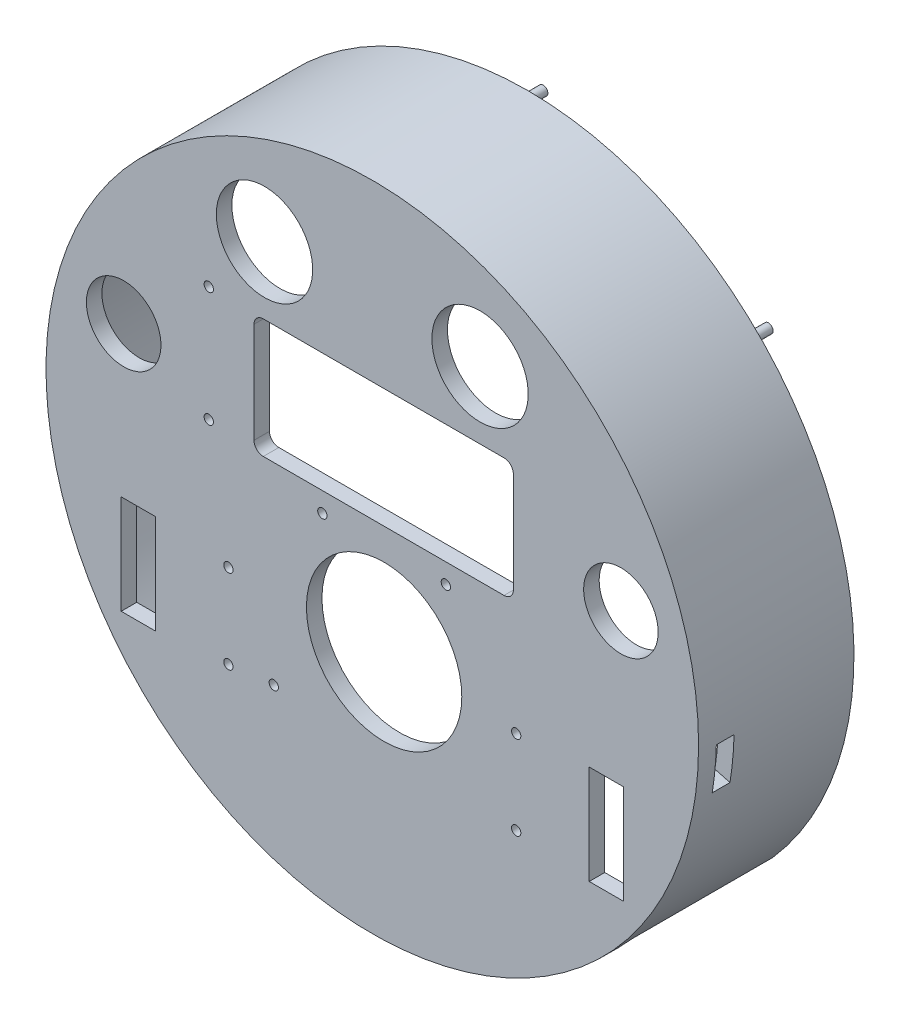
from build123d import *

# Parameters (mm, degrees)
ESQUISSE1_R              = 105
BOSS_EXTRU_1_DEPTH       = 50
COQUE1_T                 = -5
ESQUISSE3_R              = 25
ESQUISSE3_R_2            = 1.5
ENL_V_MAT_EXTRU_1_DEPTH  = 10
ENL_V_MAT_EXTRU_2_DEPTH  = 156.161206492
ENL_V_MAT_EXTRU_3_DEPTH  = 45
ESQUISSE7_R              = 1.5
ENL_V_MAT_EXTRU_4_DEPTH  = 156.161206492
ESQUISSE8_W              = 11
ESQUISSE8_H              = 31.895350387
ENL_V_MAT_EXTRU_5_DEPTH  = 5
ESQUISSE9_R              = 15.5
ENL_V_MAT_EXTRU_7_DEPTH  = 156.161206492
BALAYAGE1_PROFILE_R      = 1.5
BOSS_EXTRU_2_START       = 1
BOSS_EXTRU_2_DEPTH       = 1
BALAYAGE2_PROFILE_R      = 1.5
BOSS_EXTRU_3_START       = 2
BOSS_EXTRU_3_DEPTH       = 2
ESQUISSE30_R             = 1.5
BOSS_EXTRU_4_DEPTH       = 5
ESQUISSE31_R             = 12
ENL_V_MAT_EXTRU_8_DEPTH  = 5
ESQUISSE32_W             = 5.713355649
ESQUISSE32_H             = 13.88652285
ENL_V_MAT_EXTRU_10_DEPTH = 352.816395688


with BuildPart() as part:
    # Esquisse1 → Boss.-Extru.1 (new body)
    with BuildSketch(Plane.XY):
        Circle(ESQUISSE1_R)
    extrude(amount=BOSS_EXTRU_1_DEPTH)

    # Coque1
    coque1_openings = [part.faces().sort_by_distance(p)[0] for p in [
        (0, 0, 0),
    ]]
    offset(amount=COQUE1_T, openings=coque1_openings, kind=Kind.INTERSECTION)

    # Esquisse3 → Enlèv. mat.-Extru.1 (cut)
    with BuildSketch(Plane(origin=(0, 0, 45), x_dir=(-1, 0, 0), z_dir=(0, 0, -1))):
        with Locations((-3.8, -24.557615642)):
            Circle(ESQUISSE3_R)
        with Locations((-23.669465397, 4.134521322)):
            Circle(ESQUISSE3_R_2)
        with Locations((16.069465397, 4.134521322)):
            Circle(ESQUISSE3_R_2)
        with Locations((31.7, -51.557615642)):
            Circle(ESQUISSE3_R_2)
    extrude(amount=-ENL_V_MAT_EXTRU_1_DEPTH, mode=Mode.SUBTRACT)

    # Esquisse5 → Enlèv. mat.-Extru.2 (cut, through all)
    with BuildSketch(Plane(origin=(0, 0, 45), x_dir=(-1, 0, 0), z_dir=(0, 0, -1))):
        with BuildLine():
            Line((-42.388918531, 10.472597699), (35.07440103, 10.472597699))
            ThreePointArc((35.07440103, 10.472597699), (37.195721374, 11.351277356), (38.07440103, 13.472597699))
            Line((38.07440103, 13.472597699), (38.07440103, 45.806945365))
            ThreePointArc((38.07440103, 45.806945365), (37.195721374, 47.928265708), (35.07440103, 48.806945365))
            Line((35.07440103, 48.806945365), (-42.388918531, 48.806945365))
            ThreePointArc((-42.388918531, 48.806945365), (-44.510238875, 47.928265708), (-45.388918531, 45.806945365))
            Line((-45.388918531, 45.806945365), (-45.388918531, 13.472597699))
            ThreePointArc((-45.388918531, 13.472597699), (-44.510238875, 11.351277356), (-42.388918531, 10.472597699))
        make_face()
    extrude(amount=-ENL_V_MAT_EXTRU_2_DEPTH, mode=Mode.SUBTRACT)

    # Esquisse6 → Enlèv. mat.-Extru.3 (cut)
    with BuildSketch(Plane(origin=(0, 0, 0), x_dir=(-1, 0, 0), z_dir=(0, 0, -1))):
        with BuildLine():
            Line((-78.81072608, -69.38205427), (78.81072608, -69.38205427))
            ThreePointArc((78.81072608, -69.38205427), (0, -105), (-78.81072608, -69.38205427))
        make_face()
    extrude(amount=-ENL_V_MAT_EXTRU_3_DEPTH, mode=Mode.SUBTRACT)

    # Esquisse7 → Enlèv. mat.-Extru.4 (cut, through all)
    with BuildSketch(Plane(origin=(0, 0, 45), x_dir=(-1, 0, 0), z_dir=(0, 0, -1))):
        with Locations((52.614229855, 48.990085475)):
            Circle(ESQUISSE7_R)
        with Locations((52.614229855, 11.990085475)):
            Circle(ESQUISSE7_R)
        with Locations((46.3, -26.057615642)):
            Circle(ESQUISSE7_R)
        with Locations((46.3, -53.057615642)):
            Circle(ESQUISSE7_R)
        with Locations((-46.3, -26.062213408)):
            Circle(ESQUISSE7_R)
        with Locations((-46.3, -53.062213408)):
            Circle(ESQUISSE7_R)
    extrude(amount=-ENL_V_MAT_EXTRU_4_DEPTH, mode=Mode.SUBTRACT)

    # Esquisse8 → Enlèv. mat.-Extru.5 (cut)
    with BuildSketch(Plane(origin=(0, 0, 45), x_dir=(-1, 0, 0), z_dir=(0, 0, -1))):
        with Locations((-75.3, -39.589403314)):
            Rectangle(ESQUISSE8_W, ESQUISSE8_H)
        with Locations((75.3, -39.589403314)):
            Rectangle(ESQUISSE8_W, ESQUISSE8_H)
    extrude(amount=-ENL_V_MAT_EXTRU_5_DEPTH, mode=Mode.SUBTRACT)

    # Esquisse9 → Enlèv. mat.-Extru.7 (cut, through all)
    with BuildSketch(Plane(origin=(0, 0, 45), x_dir=(-1, 0, 0), z_dir=(0, 0, -1))):
        with Locations((34.681880454, 70.440085475)):
            Circle(ESQUISSE9_R)
        with Locations((-34.681880454, 70.440085475)):
            Circle(ESQUISSE9_R)
    extrude(amount=-ENL_V_MAT_EXTRU_7_DEPTH, mode=Mode.SUBTRACT)

    # Balayage1: sweep along a path in Esquisse10
    with BuildLine(Plane(origin=(-9.681880454, 0.440085475, 22), x_dir=(-1, 0, 0), z_dir=(0, 0, -1))) as balayage1_path:
        Line((-43.221417057, 88.965628134), (-42.925873334, 93.872357698))
    # Balayage1 profile (on start of the path) → Balayage1 (sweep)
    with BuildSketch(Plane(origin=(33.539536603, 89.405713609, 22), x_dir=(0.9981909544337458, 0.060123360573471965, 0), z_dir=(-0.060123360573471965, 0.9981909544337458, 0))):
        Circle(BALAYAGE1_PROFILE_R)
    balayage1 = sweep(path=balayage1_path.line)

    # Esquisse19 → Boss.-Extru.2 (add)
    with BuildSketch(Plane(origin=(-5.53995205, 91.976396052, 0), x_dir=(0.998190954433746, 0.06012336057346903, 0), z_dir=(-0.06012336057346903, 0.998190954433746, 0)).offset(BOSS_EXTRU_2_START)):
        with BuildLine():
            Line((38.85423401, -23.5), (38.85423401, -20.5))
            ThreePointArc((38.85423401, -20.5), (37.35423401, -22), (38.85423401, -23.5))
        make_face()
    boss_extru_2 = extrude(amount=-BOSS_EXTRU_2_DEPTH)

    # Balayage2: sweep along a path in Esquisse20
    with BuildLine(Plane(origin=(-9.681880454, 0.440085475, 22), x_dir=(-1, 0, 0), z_dir=(0, 0, -1))) as balayage2_path:
        Line((-73.311298587, 71.743577457), (-78.469516131, 72.142702967))
    # Balayage2 profile (on start of the path) → Balayage2 (sweep)
    with BuildSketch(Plane(origin=(63.629418133, 72.183662932, 22), x_dir=(-0.07714603625431019, 0.9970198037603109, 0), z_dir=(0.9970198037603109, 0.07714603625431019, 0))):
        Circle(BALAYAGE2_PROFILE_R)
    balayage2 = sweep(path=balayage2_path.line)

    # Esquisse27 → Boss.-Extru.3 (add)
    with BuildSketch(Plane(origin=(73.961032209, 5.722855705, 0), x_dir=(0, 0, -1), z_dir=(0.9970198037603113, 0.07714603625430425, 0)).offset(BOSS_EXTRU_3_START)):
        with BuildLine():
            Line((-20.5, 67.059784053), (-23.5, 67.059784053))
            ThreePointArc((-23.5, 67.059784053), (-22, 65.559784053), (-20.5, 67.059784053))
        make_face()
    boss_extru_3 = extrude(amount=-BOSS_EXTRU_3_DEPTH)

    # Symétrie1: Balayage1, Boss.-Extru.2, Balayage2, Boss.-Extru.3 across plane
    add(balayage1.mirror(Plane(origin=(0, 0, 0), x_dir=(0, 0, 1), z_dir=(1, 0, 0))))
    add(boss_extru_2.mirror(Plane(origin=(0, 0, 0), x_dir=(0, 0, 1), z_dir=(1, 0, 0))))
    add(balayage2.mirror(Plane(origin=(0, 0, 0), x_dir=(0, 0, 1), z_dir=(1, 0, 0))))
    add(boss_extru_3.mirror(Plane(origin=(0, 0, 0), x_dir=(0, 0, 1), z_dir=(1, 0, 0))))

    # Esquisse30 → Boss.-Extru.4 (add)
    with BuildSketch(Plane(origin=(0, 0, 0), x_dir=(-1, 0, 0), z_dir=(0, 0, -1))):
        with Locations(Location((0, 102.5, 0), (0, 0, 180))):
            Circle(ESQUISSE30_R)
        with Locations(Location((-72.478445072, 72.478445072, 0), (0, 0, 180))):
            Circle(ESQUISSE30_R)
        with Locations((72.478445072, 72.478445072)):
            Circle(ESQUISSE30_R)
    extrude(amount=BOSS_EXTRU_4_DEPTH)

    # Esquisse31 → Enlèv. mat.-Extru.8 (cut)
    with BuildSketch(Plane(origin=(0, 0, 45), x_dir=(-1, 0, 0), z_dir=(0, 0, -1))):
        with Locations((-80, 25)):
            Circle(ESQUISSE31_R)
        with Locations((80, 25)):
            Circle(ESQUISSE31_R)
    extrude(amount=-ENL_V_MAT_EXTRU_8_DEPTH, mode=Mode.SUBTRACT)

    # Esquisse32 → Enlèv. mat.-Extru.10 (cut, through all)
    with BuildSketch(Plane(origin=(91.985124309, -26.801506348, -210), x_dir=(0, 0, -1), z_dir=(0.9659258262890654, -0.25881904510253173, 0))):
        with Locations((-251.407492867, 19.659218808)):
            Rectangle(ESQUISSE32_W, ESQUISSE32_H)
    extrude(amount=ENL_V_MAT_EXTRU_10_DEPTH, mode=Mode.SUBTRACT)


solid = part.part
